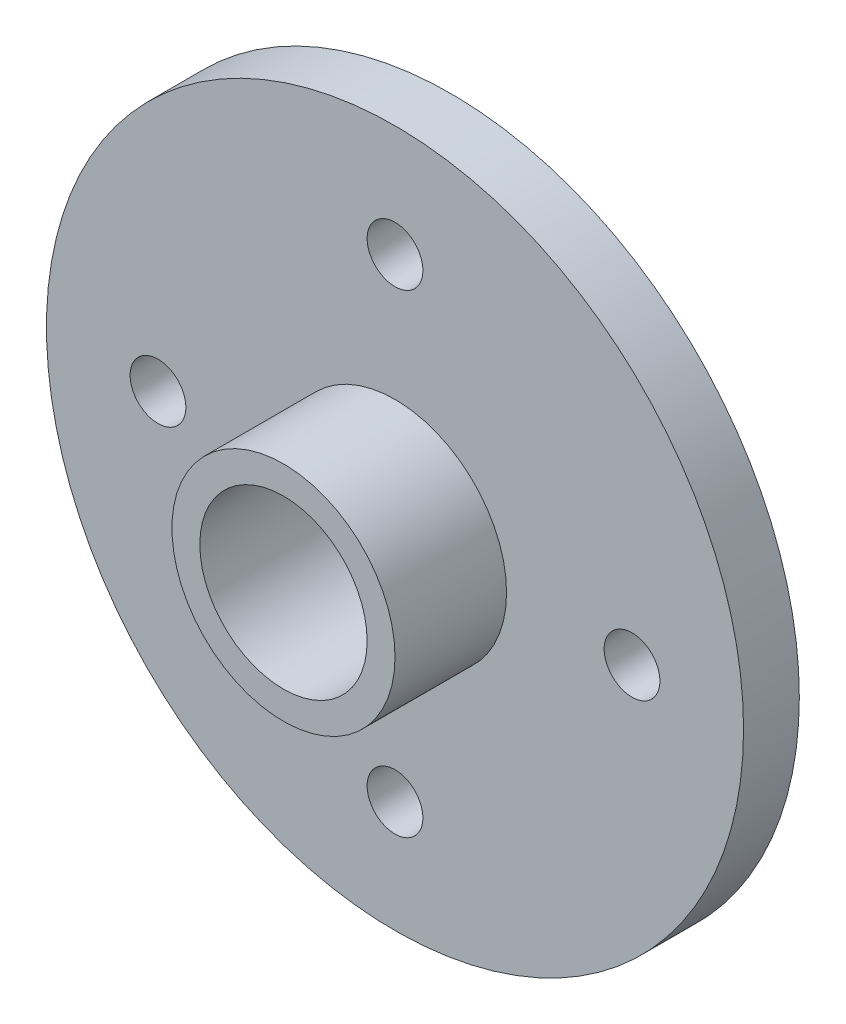
from build123d import *

# Parameters (mm, degrees)
SKETCH1_R           = 12.5
SKETCH1_R_2         = 1
BOSS_EXTRUDE1_DEPTH = 2
SKETCH2_R           = 4
SKETCH2_R_2         = 3
BOSS_EXTRUDE2_DEPTH = 4
SKETCH3_R           = 3
CUT_EXTRUDE1_DEPTH  = 19.668154703


with BuildPart() as part:
    # Sketch1 → Boss-Extrude1 (new body)
    with BuildSketch(Plane.XY):
        Circle(SKETCH1_R)
        with Locations((-8.5, 0)):
            Circle(SKETCH1_R_2, mode=Mode.SUBTRACT)
        with Locations((0, 8.5)):
            Circle(SKETCH1_R_2, mode=Mode.SUBTRACT)
        with Locations((8.5, 0)):
            Circle(SKETCH1_R_2, mode=Mode.SUBTRACT)
        with Locations((0, -8.5)):
            Circle(SKETCH1_R_2, mode=Mode.SUBTRACT)
    extrude(amount=BOSS_EXTRUDE1_DEPTH)

    # Sketch2 → Boss-Extrude2 (add)
    with BuildSketch(Plane.XY.offset(2)):
        Circle(SKETCH2_R)
        Circle(SKETCH2_R_2, mode=Mode.SUBTRACT)
    extrude(amount=BOSS_EXTRUDE2_DEPTH)

    # Sketch3 → Cut-Extrude1 (cut, through all)
    with BuildSketch(Plane(origin=(0, 0, 0), x_dir=(-1, 0, 0), z_dir=(0, 0, -1))):
        Circle(SKETCH3_R)
    extrude(amount=-CUT_EXTRUDE1_DEPTH, mode=Mode.SUBTRACT)


solid = part.part
